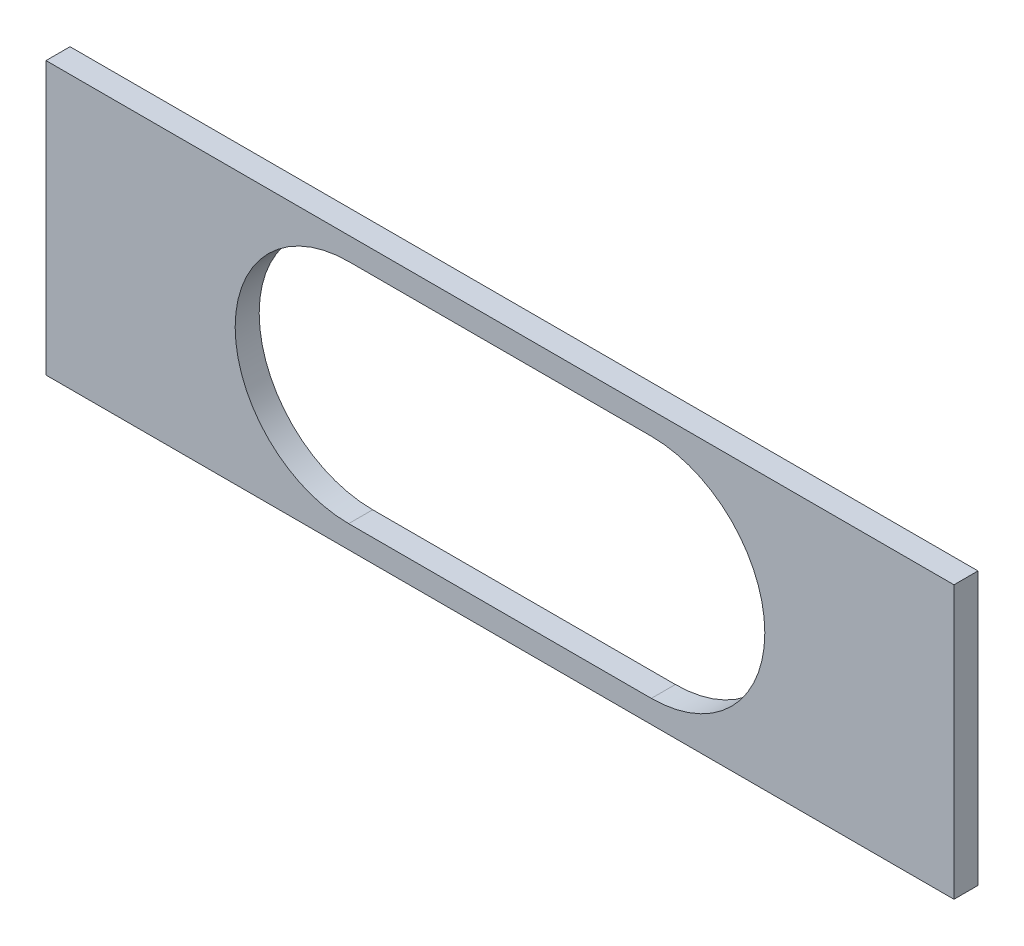
from build123d import *

# Parameters (mm, degrees)
SKETCH1_W           = 120
SKETCH1_H           = 36
BOSS_EXTRUDE1_DEPTH = 3.175
CUT_EXTRUDE1_DEPTH  = 63.72224984
SKETCH5_R           = 1
CUT_EXTRUDE2_DEPTH  = 0.5


with BuildPart() as part:
    # Sketch1 → Boss-Extrude1 (new body)
    with BuildSketch(Plane.XY):
        Rectangle(SKETCH1_W, SKETCH1_H)
    extrude(amount=BOSS_EXTRUDE1_DEPTH)

    # Sketch2 → Cut-Extrude1 (cut, through all)
    with BuildSketch(Plane.XY.offset(3.175)):
        with BuildLine():
            Line((20, -15), (-20, -15))
            ThreePointArc((-20, -15), (-35, 0), (-20, 15))
            Line((-20, 15), (20, 15))
            ThreePointArc((20, 15), (35, 0), (20, -15))
        make_face()
    extrude(amount=-CUT_EXTRUDE1_DEPTH, mode=Mode.SUBTRACT)

    # Sketch5 → Cut-Extrude2 (cut)
    with BuildSketch(Plane(origin=(0, 0, 0), x_dir=(-1, 0, 0), z_dir=(0, 0, -1))):
        with Locations((-50, 10)):
            Circle(SKETCH5_R)
        with Locations((-50, -10)):
            Circle(SKETCH5_R)
        with Locations((50, -10)):
            Circle(SKETCH5_R)
        with Locations((50, 10)):
            Circle(SKETCH5_R)
    extrude(amount=-CUT_EXTRUDE2_DEPTH, mode=Mode.SUBTRACT)


solid = part.part
